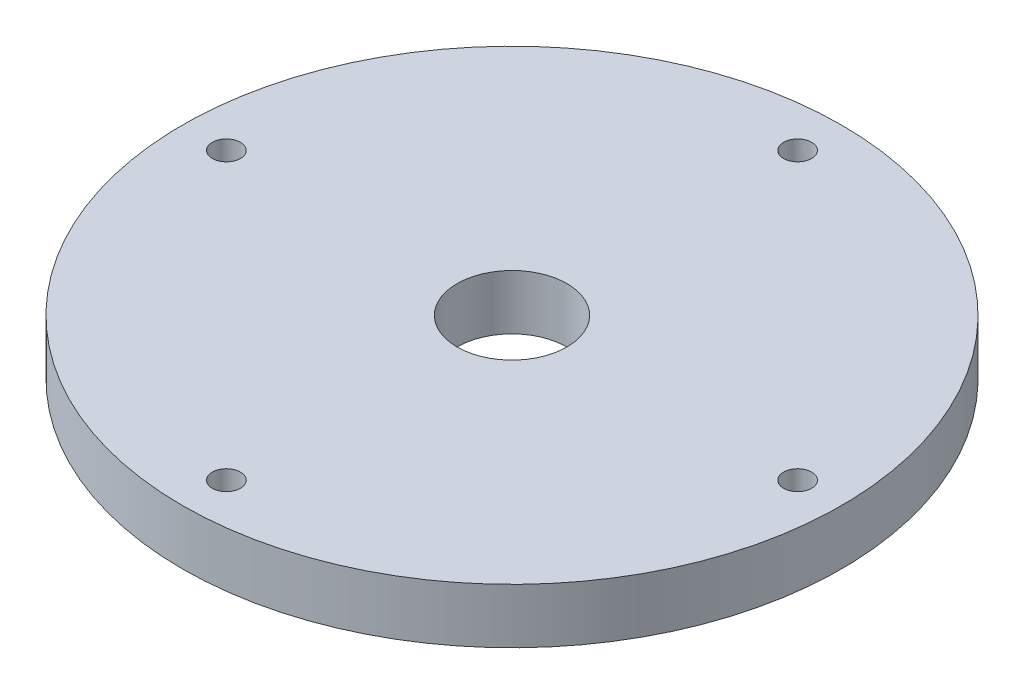
from build123d import *

# Parameters (mm, degrees)
SKETCH1_R           = 38.1
SKETCH1_R_2         = 1.6256
SKETCH1_R_3         = 6.35
BOSS_EXTRUDE1_DEPTH = 6.35


with BuildPart() as part:
    # Sketch1 → Boss-Extrude1 (new body)
    with BuildSketch(Plane(origin=(0, 0, 0), x_dir=(1, 0, 0), z_dir=(0, 1, 0))):
        with Locations(Location((0, 0, 0), (0, 0, 270))):
            Circle(SKETCH1_R)
        with Locations(Location((0, 33.02, 0), (0, 0, 270))):
            Circle(SKETCH1_R_2, mode=Mode.SUBTRACT)
        with Locations(Location((33.02, 0, 0), (0, 0, 270))):
            Circle(SKETCH1_R_2, mode=Mode.SUBTRACT)
        with Locations(Location((0, -33.02, 0), (0, 0, 270))):
            Circle(SKETCH1_R_2, mode=Mode.SUBTRACT)
        with Locations(Location((-33.02, 0, 0), (0, 0, 270))):
            Circle(SKETCH1_R_2, mode=Mode.SUBTRACT)
        with Locations(Location((0, 0, 0), (0, 0, 270))):
            Circle(SKETCH1_R_3, mode=Mode.SUBTRACT)
    extrude(amount=BOSS_EXTRUDE1_DEPTH)


solid = part.part
